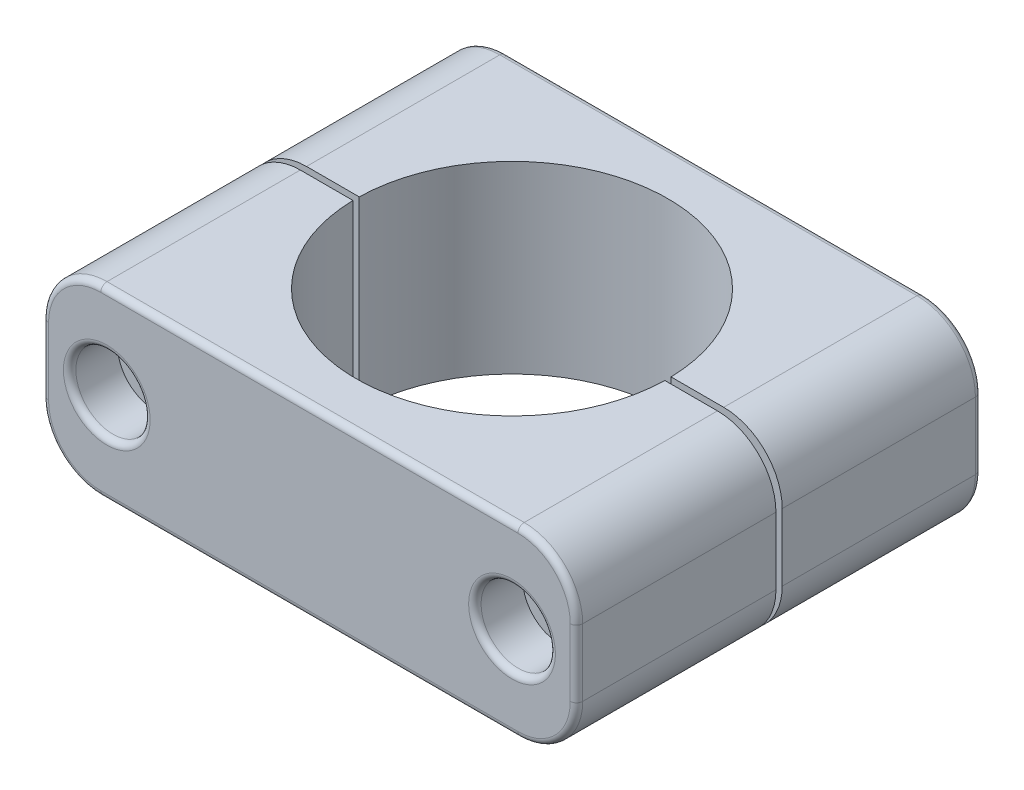
from build123d import *

# Parameters (mm, degrees)
SKETCH1_W          = 87
SKETCH1_H          = 66
SKETCH1_R          = 25.4
EXTRUDE1_DEPTH     = 15
FILLET1_R          = 9.525
FILLET2_R          = 1.016
SKETCH3_W          = 94.004218742
SKETCH3_H          = 1.016
CUT_EXTRUDE1_DEPTH = 25.4


with BuildPart() as part:
    # Sketch1 → Extrude1 (new, symmetric)
    with BuildSketch(Plane(origin=(0, 0, 0), x_dir=(1, 0, 0), z_dir=(0, 1, 0))):
        Rectangle(SKETCH1_W, SKETCH1_H)
        with Locations(Location((0, 0, 0), (0, 0, 270))):
            Circle(SKETCH1_R, mode=Mode.SUBTRACT)
    extrude(amount=EXTRUDE1_DEPTH, both=True)

    # Sketch4 → Cut-Revolve1 (revolve, cut)
    with BuildSketch(Plane(origin=(33, 0, 0), x_dir=(0, 0, -1), z_dir=(1, 0, 0)), mode=Mode.PRIVATE) as cut_revolve1_sk:
        Polygon((-40.8, 0), (40.8, 0), (40.8, 6.05), (25.2, 6.05), (25.2, 3.302), (-25.2, 3.302), (-25.2, 6.05), (-40.8, 6.05), align=None)
    cut_revolve1 = revolve(cut_revolve1_sk.sketch.rotate(Axis((33, 0, -40.8), (0, 0, -1)), 90), axis=Axis((33, 0, -40.8), (0, 0, -1)), mode=Mode.SUBTRACT)

    # Mirror1: Cut-Revolve1 across plane
    add(cut_revolve1.mirror(Plane(origin=(0, 0, 0), x_dir=(0, 0, 1), z_dir=(1, 0, 0))), mode=Mode.SUBTRACT)

    # Fillet1
    fillet1_edges = [part.edges().sort_by_distance(p)[0] for p in [
        (43.5, 15, 0),
        (-43.5, 15, 0),
        (43.5, -15, 0),
        (-43.5, -15, 0),
    ]]
    fillet(fillet1_edges, radius=FILLET1_R)

    # Fillet2
    fillet2_edges = [part.edges().sort_by_distance(p)[0] for p in [
        (26.95, 0, -33),
        (26.95, 0, 33),
        (-26.95, 0, -33),
        (-26.95, 0, 33),
        (-43.5, 0, 33),
        (-43.5, 0, -33),
        (0, -15, 33),
        (43.5, 0, 33),
        (0, 15, 33),
        (40.710192091, 12.210192091, 33),
        (40.710192091, -12.210192091, 33),
        (-40.710192091, 12.210192091, 33),
        (-40.710192091, -12.210192091, 33),
        (0, -15, -33),
        (0, 15, -33),
        (43.5, 0, -33),
        (40.710192091, 12.210192091, -33),
        (40.710192091, -12.210192091, -33),
        (-40.710192091, 12.210192091, -33),
        (-40.710192091, -12.210192091, -33),
    ]]
    fillet(fillet2_edges, radius=FILLET2_R)

    # Sketch3 → Cut-Extrude1 (cut, symmetric)
    with BuildSketch(Plane(origin=(0, 0, 0), x_dir=(-1, 0, 0), z_dir=(0, 1, 0))):
        with Locations((-0.814909873, 0)):
            Rectangle(SKETCH3_W, SKETCH3_H)
    extrude(amount=CUT_EXTRUDE1_DEPTH, both=True, mode=Mode.SUBTRACT)


with BuildPart() as cut_extrude1_piece_1:
    # of the separate pieces the step leaves, piece 1, a body of its own (cut_extrude1_pieces)
    add(part.part.solids().sort_by_distance((-43.5, 5.475, -31.984))[0])


with BuildPart() as cut_extrude1_piece_2:
    # of the separate pieces the step leaves, piece 2, a body of its own (cut_extrude1_pieces)
    add(part.part.solids().sort_by_distance((40.066, 0, 33))[0])


solid = Compound([cut_extrude1_piece_1.part, cut_extrude1_piece_2.part])
